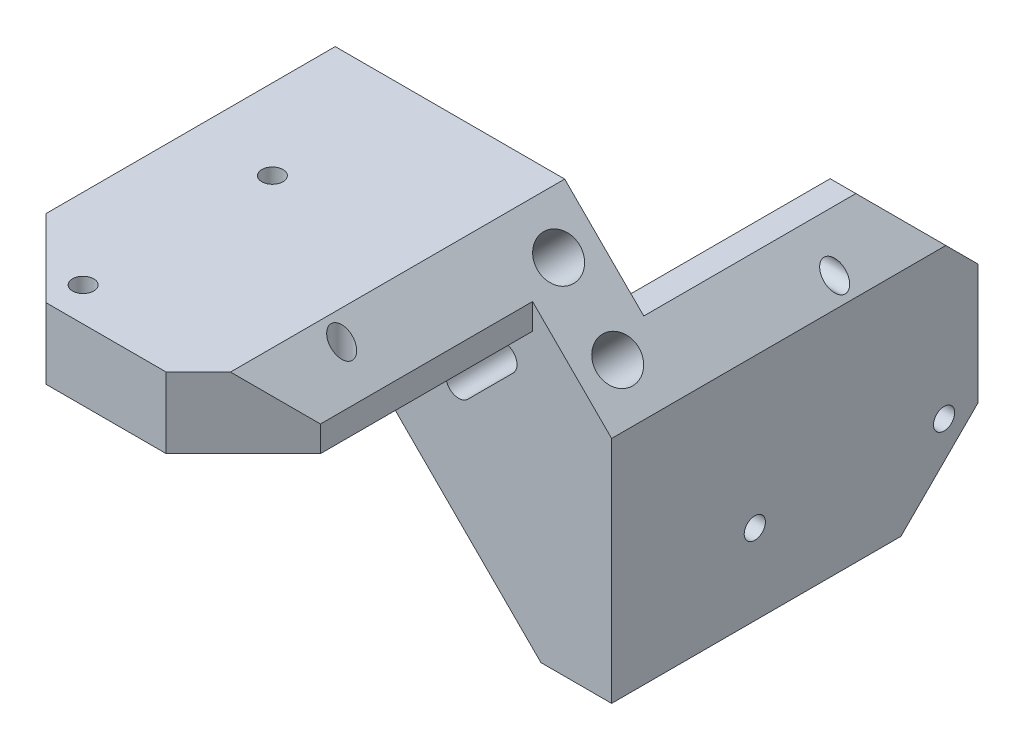
from build123d import *

# Parameters (mm, degrees)
SKETCH_1_W                = 55
SKETCH_1_H                = 55
EXTRUDE_1_DEPTH           = 51
CUT_EXTRUDE_1_DEPTH       = 110.162722575
CHAMFER_1_SIZE            = 19.3
CUT_EXTRUDE_START         = -11
SKETCH_11_W               = 55
SKETCH_11_H               = 45
CUT_EXTRUDE_2_DEPTH       = 69.888985474
CUT_EXTRUDE_START_2       = 11
SKETCH_12_W               = 55
SKETCH_12_H               = 45
CUT_EXTRUDE_3_DEPTH       = 69.888985474
HOLE_WIZARD_M4_1_D        = 3.3
HOLE_WIZARD_M4_2_D        = 3.3
HOLE_WIZARD_1_D           = 6.6
HOLE_WIZARD_1_CBORE_D     = 11
HOLE_WIZARD_1_CBORE_DEPTH = 8
CUT_EXTRUDE_5_DEPTH       = 73.754724932
CUT_EXTRUDE_6_DEPTH       = 73.754724932
CHAMFER_2_SIZE            = 12
CUT_EXTRUDE_7_DEPTH       = 70.003623093


with BuildPart() as part:
    # 草图1 → 凸台-拉伸1 (new, symmetric)
    with BuildSketch(Plane.XY):
        Rectangle(SKETCH_1_W, SKETCH_1_H)
    extrude(amount=EXTRUDE_1_DEPTH, both=True)

    # 草图2 → 切除-拉伸1 (cut, through all)
    with BuildSketch(Plane.XY.offset(51)):
        Polygon((-27.5, -27.5), (16.5, -27.5), (-27.5, 16.5), align=None)
    extrude(amount=-CUT_EXTRUDE_1_DEPTH, mode=Mode.SUBTRACT)

    # 倒角1
    chamfer_1_edges = [part.edges().sort_by_distance(p)[0] for p in [
        (27.5, 27.5, 0),
    ]]
    chamfer(chamfer_1_edges, length=CHAMFER_1_SIZE)

    # 草图11 → 切除-拉伸2 (cut, through all)
    with BuildSketch(Plane.YZ.offset(27.5).offset(CUT_EXTRUDE_START)):
        with Locations((0, -28.5)):
            Rectangle(SKETCH_11_W, SKETCH_11_H)
    extrude(amount=-CUT_EXTRUDE_2_DEPTH, mode=Mode.SUBTRACT)

    # 草图12 → 切除-拉伸3 (cut, through all)
    with BuildSketch(Plane.XZ.offset(-27.5).offset(CUT_EXTRUDE_START_2)):
        with Locations((0, 28.5)):
            Rectangle(SKETCH_12_W, SKETCH_12_H)
    extrude(amount=CUT_EXTRUDE_3_DEPTH, mode=Mode.SUBTRACT)

    # M4 螺纹孔1 (through all)
    with Locations(Plane(origin=(16.5, -23.392318354, -4.126238011), x_dir=(0, 1, 0), z_dir=(-1, 0, 0))):
        with Locations((33.892318354, 26.873761989), (8.392318354, 41.596193853), (8.392318354, 12.151330125)):
            Hole(HOLE_WIZARD_M4_1_D / 2)

    # M4 螺纹孔2 (through all)
    with Locations(Plane(origin=(-3.776378322, 16.5, -11.360569787), x_dir=(-1, 0, 0), z_dir=(0, -1, 0))):
        with Locations((-14.276378322, -42.360569787), (11.223621678, -57.083001652), (11.223621678, -27.638137923)):
            Hole(HOLE_WIZARD_M4_2_D / 2)

    # 打孔尺寸根据内六角圆柱头螺钉的类型1 (through all)
    with Locations(Plane(origin=(-5.5, -5.5, 0), x_dir=(-0.7071067811865475, 0.7071067811865477, 0), z_dir=(-0.7071067811865477, -0.7071067811865475, 0))):
        with Locations((6.5, 0), (-6.5, 0)):
            CounterBoreHole(HOLE_WIZARD_1_D / 2, HOLE_WIZARD_1_CBORE_D / 2, HOLE_WIZARD_1_CBORE_DEPTH)

    # 草图22 → 切除-拉伸5 (cut, through all)
    with BuildSketch(Plane.XZ.offset(-16.5)):
        Polygon((3.2, 51), (15.2, 39), (15.2, 6), (19.2, 6), (19.2, 51), align=None)
    extrude(amount=-CUT_EXTRUDE_5_DEPTH, mode=Mode.SUBTRACT)

    # 草图23 → 切除-拉伸6 (cut, through all)
    with BuildSketch(Plane.ZY.offset(-16.5)):
        Polygon((-51, 19.2), (-51, 3.2), (-39, 15.2), (-6, 15.2), (-6, 19.2), align=None)
    extrude(amount=-CUT_EXTRUDE_6_DEPTH, mode=Mode.SUBTRACT)

    # 倒角2
    chamfer_2_edges = [part.edges().sort_by_distance(p)[0] for p in [
        (-27.5, 22, 51),
        (22, -27.5, -51),
    ]]
    chamfer(chamfer_2_edges, length=CHAMFER_2_SIZE)

    # 草图24 → 切除-拉伸7 (cut, through all)
    with BuildSketch(Plane(origin=(0, 0, -6), x_dir=(-1, 0, 0), z_dir=(0, 0, -1))):
        with BuildLine():
            Line((-5.122077939, 2.293650814), (-12.193145751, 9.364718626))
            ThreePointArc((-12.193145751, 9.364718626), (-12.193145751, 12.193145751), (-9.364718626, 12.193145751))
            Line((-9.364718626, 12.193145751), (-2.293650814, 5.122077939))
            ThreePointArc((-2.293650814, 5.122077939), (-2.293650814, 2.293650814), (-5.122077939, 2.293650814))
        make_face()
    extrude(amount=-CUT_EXTRUDE_7_DEPTH, mode=Mode.SUBTRACT)


solid = part.part
